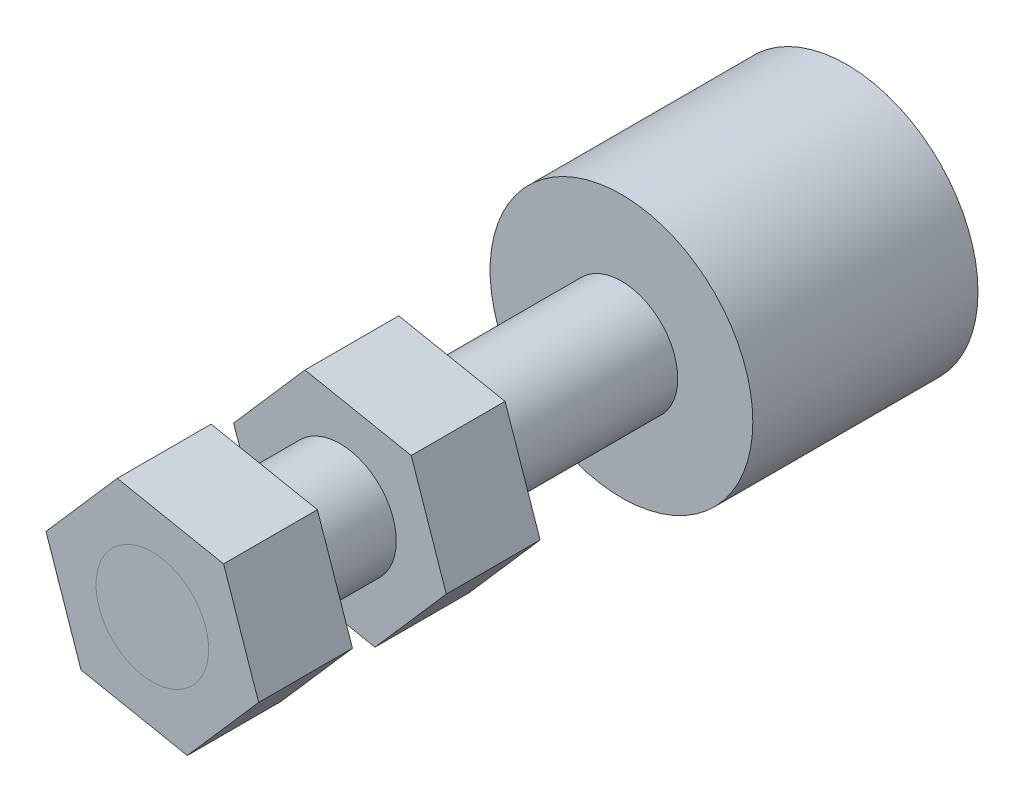
from build123d import *

# Parameters (mm, degrees)
SKETCH_1_R             = 7
EXTRUDE_1_DEPTH        = 12
SKETCH_2_R             = 3
EXTRUDE_2_DEPTH        = 25
SKETCH_3_R             = 3
EXTRUDE_3_DEPTH        = 5
PATTERN_LINEAR_1_COUNT = 2
PATTERN_LINEAR_1_PITCH = 10


with BuildPart() as part:
    # 草图1 → 凸台-拉伸1 (new body)
    with BuildSketch(Plane.XY):
        Circle(SKETCH_1_R)
    extrude(amount=EXTRUDE_1_DEPTH)

    # 草图2 → 凸台-拉伸2 (add)
    with BuildSketch(Plane.XY.offset(12)):
        Circle(SKETCH_2_R)
    extrude(amount=EXTRUDE_2_DEPTH)


with BuildPart() as body_2:
    # 草图3 → 凸台-拉伸3 (new body)
    with BuildSketch(Plane.XY.offset(37)):
        Polygon((3.798234894, 4.348188706), (-1.866524433, 5.463462261), (-5.664759327, 1.115273555), (-3.798234894, -4.348188706), (1.866524433, -5.463462261), (5.664759327, -1.115273555), align=None)
        Circle(SKETCH_3_R, mode=Mode.SUBTRACT)
    extrude(amount=-EXTRUDE_3_DEPTH)


with BuildPart() as pattern_linear_1_1:
    # 阵列(线性)1: pattern copy
    add(body_2.part.moved(Location(Vector(0, 0, -1) * (1 * PATTERN_LINEAR_1_PITCH))))


solid = Compound([part.part, body_2.part, pattern_linear_1_1.part])
